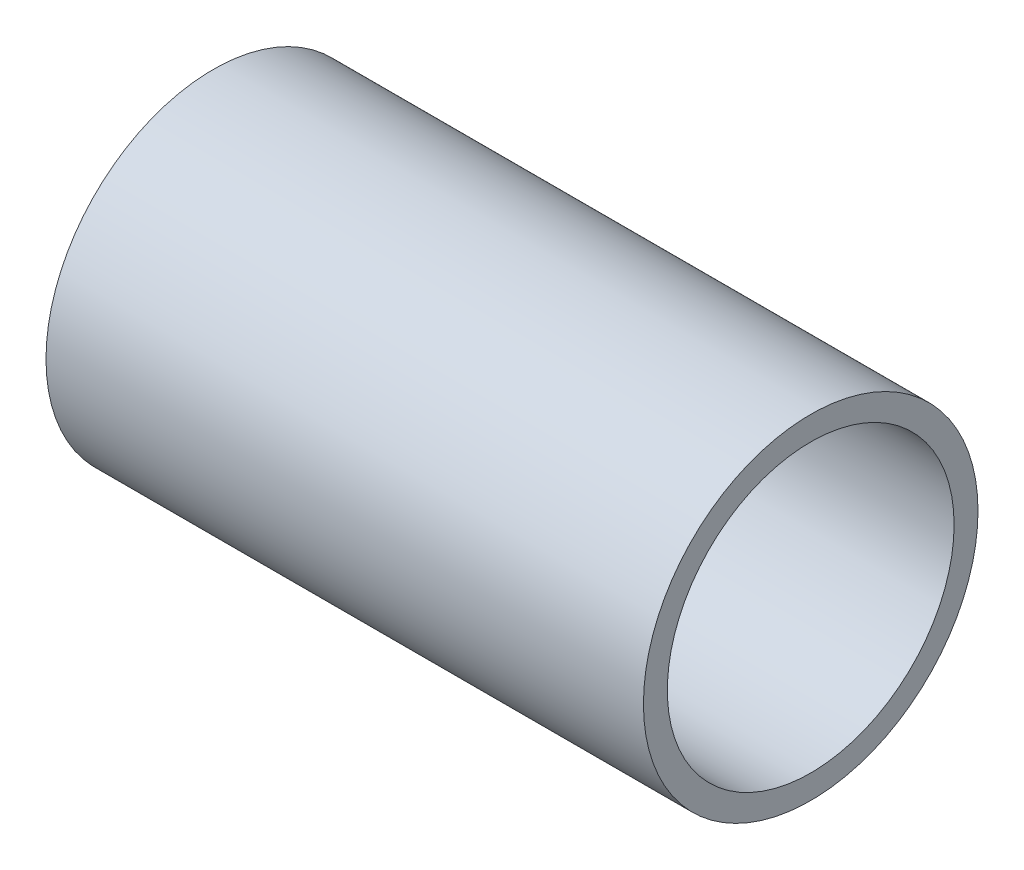
from build123d import *

# Parameters (mm, degrees)
SKETCH1_R           = 22.225
SKETCH1_R_2         = 19.051016
BOSS_EXTRUDE1_DEPTH = 79.375


with BuildPart() as part:
    # Sketch1 → Boss-Extrude1 (new body)
    with BuildSketch(Plane.ZY.offset(63.850505807)):
        with Locations(Location((19.994903538, -1.763701117, 0), (0, 0, 180))):
            Circle(SKETCH1_R)
        with Locations(Location((19.994903538, -1.763701117, 0), (0, 0, 180))):
            Circle(SKETCH1_R_2, mode=Mode.SUBTRACT)
    extrude(amount=BOSS_EXTRUDE1_DEPTH)


solid = part.part
